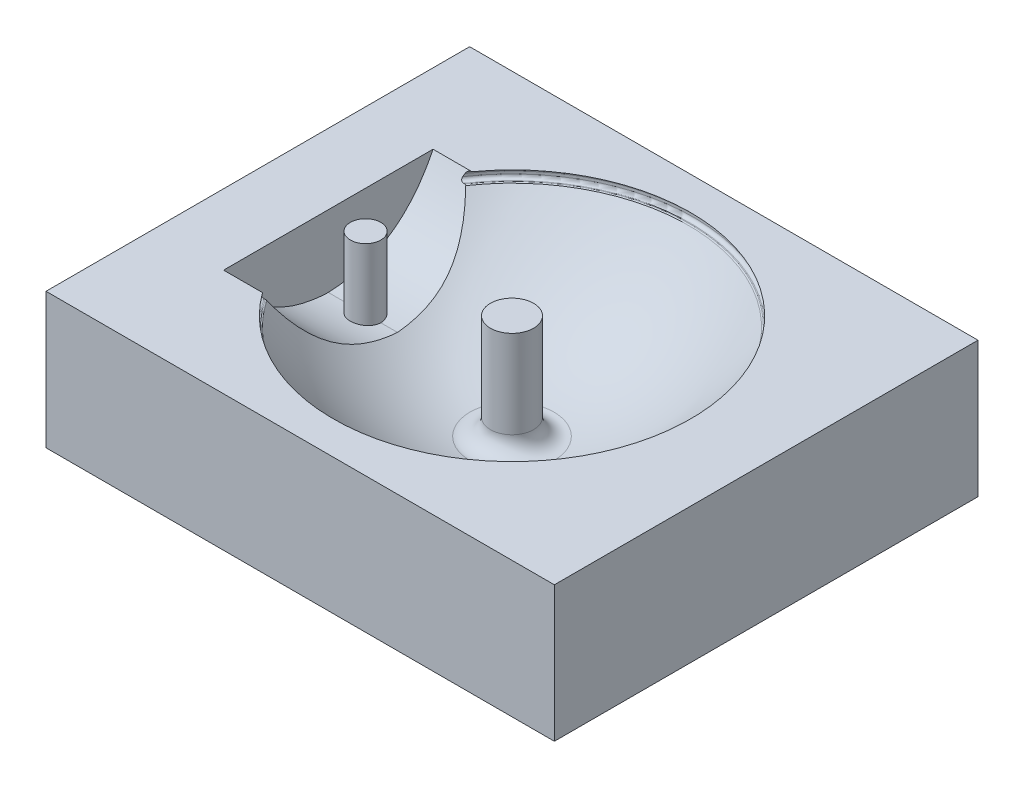
from build123d import *

# Parameters (mm, degrees)
BOSS_EXTRUDE1_DEPTH      = 42
SKETCH4_R                = 12.745
CUT_EXTRUDE2_DEPTH       = 231.623535649
SKETCH7_R                = 9
CUT_EXTRUDE4_DEPTH       = 231.513348808
BOSS_EXTRUDE2_DEPTH      = 20
BOSS_EXTRUDE2_DEPTH_BACK = 60
BOSS_EXTRUDE2_START      = -20
SKETCH8_W                = 300
SKETCH8_H                = 250
FILLET1_R                = 10


with BuildPart() as part:
    # Sketch1 → Revolve1 (revolve)
    with BuildSketch(Plane.XY):
        with BuildLine():
            Line((0, -2.75), (0, 0))
            Line((0, 0), (86.4, 0))
            Line((86.4, 0), (86.4, -51.52))
            add(Edge.make_bspline(
                [(0, -2.75), (26.471278047, -40.623393059), (56.78647802, -59.047909877), (86.4, -51.52)],
                knots=[0, 0, 0, 0, 0.721198988, 0.721198988, 0.721198988, 0.721198988], degree=3))
        make_face()
        with BuildLine():
            ThreePointArc((-18.514834727, -5.5), (-18.086269469, -5.596489171), (-17.740408022, -5.867336362))
            add(Edge.make_bspline(
                [(-17.740408022, -5.867336362), (28.13170189, -65.595276468), (86.4, -63.74)],
                knots=[0, 0, 0, 0.824732104, 0.824732104, 0.824732104], degree=2))
            Line((86.4, -63.74), (86.4, -51.52))
            add(Edge.make_bspline(
                [(0, -2.75), (26.471278047, -40.623393059), (56.78647802, -59.047909877), (86.4, -51.52)],
                knots=[0, 0, 0, 0, 0.721198988, 0.721198988, 0.721198988, 0.721198988], degree=3))
            Line((0, -2.75), (0, 0))
            Line((0, 0), (-19.04, 0))
            ThreePointArc((-19.04, 0), (-20.454213562, -0.585786438), (-21.04, -2))
            Line((-21.04, -2), (-21.04, -3.5))
            ThreePointArc((-21.04, -3.5), (-20.454213562, -4.914213562), (-19.04, -5.5))
            Line((-19.04, -5.5), (-18.514834727, -5.5))
        make_face()
    revolve(axis=Axis((86.4, 0, 0), (0, -1, 0)))

    # Sketch3 → Boss-Extrude1 (add)
    with BuildSketch(Plane(origin=(20, 0, 0), x_dir=(0, 0, -1), z_dir=(1, 0, 0))):
        with BuildLine():
            Line((-61.8, 0), (61.8, 0))
            add(Edge.make_bspline(
                [(61.8, 0), (41.99440737, -40.763024165), (0, -42.307560131)],
                knots=[0, 0, 0, 1, 1, 1], degree=2))
            add(Edge.make_bspline(
                [(-61.8, 0), (-41.99440737, -40.763024165), (0, -42.307560131)],
                knots=[0, 0, 0, 1, 1, 1], degree=2))
        make_face()
    extrude(amount=-BOSS_EXTRUDE1_DEPTH)

    # Sketch4 → Cut-Extrude2 (cut, through all)
    with BuildSketch(Plane(origin=(0, 0, 0), x_dir=(1, 0, 0), z_dir=(0, 1, 0))):
        with Locations(Location((86.4, 0, 0), (0, 0, 180))):
            Circle(SKETCH4_R)
    extrude(amount=-CUT_EXTRUDE2_DEPTH, mode=Mode.SUBTRACT)

    # Sketch7 → Cut-Extrude4 (cut, through all)
    with BuildSketch(Plane(origin=(0, 0, 0), x_dir=(1, 0, 0), z_dir=(0, 1, 0))):
        with Locations(Location((0, 0, 0), (0, 0, 180))):
            Circle(SKETCH7_R)
    extrude(amount=-CUT_EXTRUDE4_DEPTH, mode=Mode.SUBTRACT)


with BuildPart() as body_2:
    # Sketch8 → Boss-Extrude2 (new, two sides: drawn at the far end of the back side and taken through both)
    with BuildSketch(Plane(origin=(0, 0, 0), x_dir=(1, 0, 0), z_dir=(0, 1, 0)).offset(BOSS_EXTRUDE2_START - BOSS_EXTRUDE2_DEPTH_BACK)):
        with Locations((86.4, 0)):
            Rectangle(SKETCH8_W, SKETCH8_H)
    extrude(amount=BOSS_EXTRUDE2_DEPTH + BOSS_EXTRUDE2_DEPTH_BACK)

    # Combine1: cut part
    add(part.part, mode=Mode.SUBTRACT)

    # Fillet1
    fillet1_edges = [body_2.edges().sort_by_distance(p)[0] for p in [
        (99.145000004, -63.396409238, 2e-09),
    ]]
    fillet(fillet1_edges, radius=FILLET1_R)


solid = body_2.part
